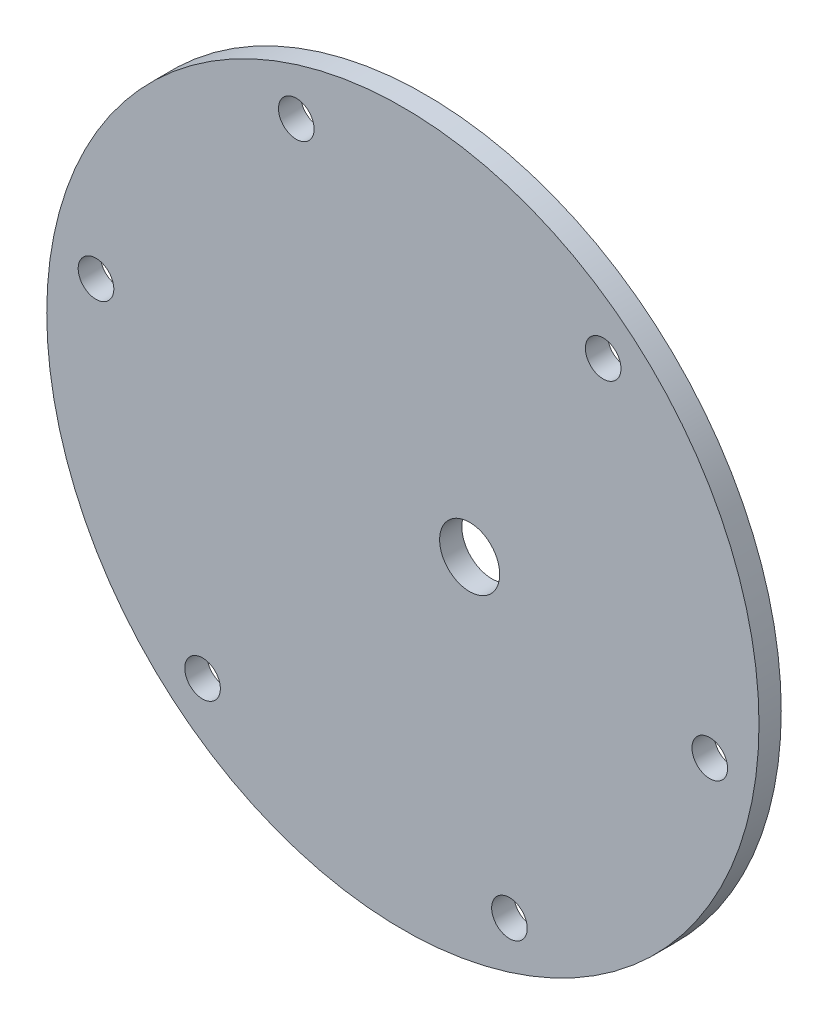
from build123d import *

# Parameters (mm, degrees)
ESBO_O1_R                  = 80
RESSALTO_EXTRUS_O1_DEPTH   = 5
CORTE_EXTRUS_O1_DEPTH      = 114.247516529
CORTE_EXTRUS_O1_DEPTH_BACK = 114.247516529
ESBO_O3_R                  = 6.75
CORTE_EXTRUS_O2_DEPTH      = 114.247516529
CORTE_EXTRUS_O2_DEPTH_BACK = 114.247516529
ESBO_O5_R                  = 4


with BuildPart() as part:
    # Esboço1 → Ressalto-extrusão1 (new body)
    with BuildSketch(Plane.XY):
        Circle(ESBO_O1_R)
    extrude(amount=RESSALTO_EXTRUS_O1_DEPTH)

    # Esboço3 → Corte-extrusão1 (cut, two sides: drawn at the far end of the back side and taken through both)
    with BuildSketch(Plane(origin=(0, 0, 0), x_dir=(-1, 0, 0), z_dir=(0, 0, -1)).offset(-CORTE_EXTRUS_O1_DEPTH_BACK)):
        with Locations((-15, 0)):
            Circle(ESBO_O3_R)
    extrude(amount=CORTE_EXTRUS_O1_DEPTH + CORTE_EXTRUS_O1_DEPTH_BACK, mode=Mode.SUBTRACT)

    # Esboço5 → Corte-extrusão2 (cut, two sides: drawn at the far end of the back side and taken through both)
    with BuildSketch(Plane(origin=(0, 0, 0), x_dir=(-1, 0, 0), z_dir=(0, 0, -1)).offset(-CORTE_EXTRUS_O2_DEPTH_BACK)):
        with Locations((23.941410033, 65.778483455)):
            Circle(ESBO_O5_R)
        with Locations((68.936542711, 12.155372437)):
            Circle(ESBO_O5_R)
        with Locations((44.995132678, -53.623111018)):
            Circle(ESBO_O5_R)
        with Locations((-23.941410033, -65.778483455)):
            Circle(ESBO_O5_R)
        with Locations((-68.936542711, -12.155372437)):
            Circle(ESBO_O5_R)
        with Locations((-44.995132678, 53.623111018)):
            Circle(ESBO_O5_R)
    extrude(amount=CORTE_EXTRUS_O2_DEPTH + CORTE_EXTRUS_O2_DEPTH_BACK, mode=Mode.SUBTRACT)


solid = part.part
